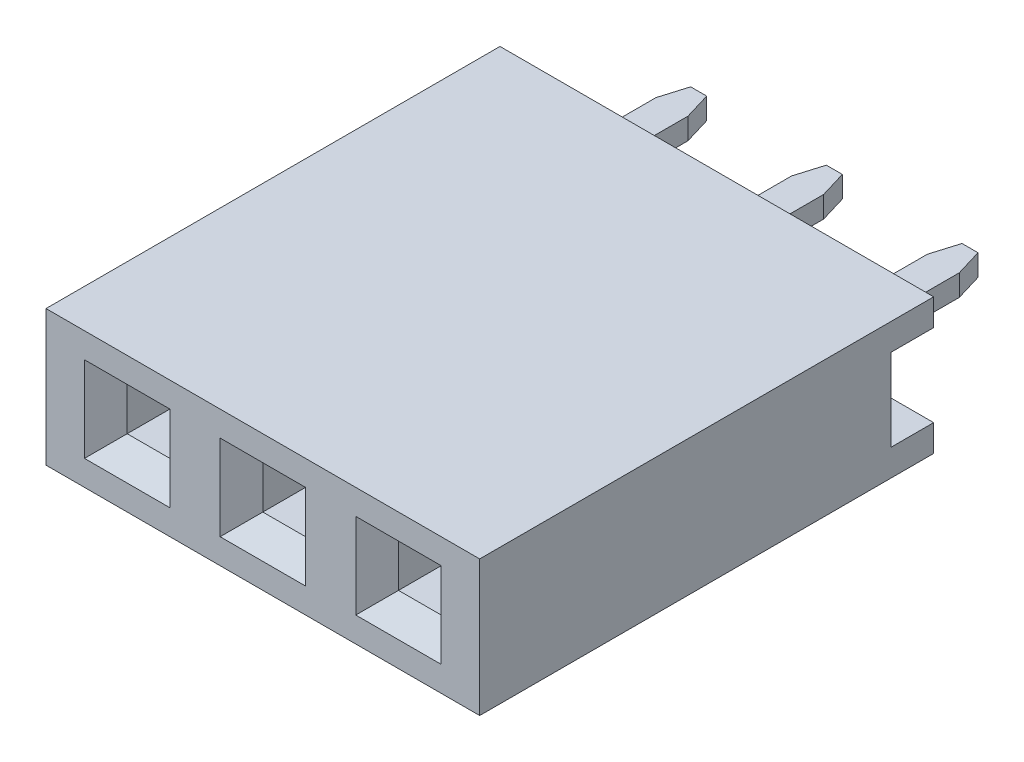
from build123d import *

# Parameters (mm, degrees)
SKETCH1_W           = 2.54
SKETCH1_H           = 8.5
BOSS_EXTRUDE1_DEPTH = 1.52
SKETCH_1_W          = 0.8
SKETCH_1_H          = 1.54
CUT_EXTRUDE_1_DEPTH = 10.116166958
SKETCH2_W           = 0.8
SKETCH2_H           = 0.8
CUT_EXTRUDE1_DEPTH  = 7
CHAMFER_1_SIZE      = 0.4
BOSS_EXTRUDE2_DEPTH = 0.2
LPATTERN1_COUNT     = 3
LPATTERN1_PITCH     = 2.54


with BuildPart() as part:
    # Sketch1 → Boss-Extrude1 (new, symmetric)
    with BuildSketch(Plane(origin=(0, 0, 0), x_dir=(0, -1, 0), z_dir=(1, 0, 0))):
        with Locations((0, -4.25)):
            Rectangle(SKETCH1_W, SKETCH1_H)
    extrude(amount=BOSS_EXTRUDE1_DEPTH, both=True)

    # Эскиз1 → Вырез-Вытянуть1 (cut, through all)
    with BuildSketch(Plane(origin=(1.52, 0, 0), x_dir=(0, 0, -1), z_dir=(1, 0, 0))):
        with Locations((-0.4, 0)):
            Rectangle(SKETCH_1_W, SKETCH_1_H)
    extrude(amount=-CUT_EXTRUDE_1_DEPTH, mode=Mode.SUBTRACT)

    # Sketch2 → Cut-Extrude1 (cut)
    with BuildSketch(Plane(origin=(0, 0, 8.5), x_dir=(-1, 0, 0), z_dir=(0, 0, 1))):
        Rectangle(SKETCH2_W, SKETCH2_H)
    extrude(amount=-CUT_EXTRUDE1_DEPTH, mode=Mode.SUBTRACT)

    # Фаска1
    chamfer_1_edges = [part.edges().sort_by_distance(p)[0] for p in [
        (-0.4, 0, 8.5),
        (0, -0.4, 8.5),
        (0.4, 0, 8.5),
        (0, 0.4, 8.5),
    ]]
    chamfer(chamfer_1_edges, length=CHAMFER_1_SIZE)

    # Sketch3 → Boss-Extrude2 (add, symmetric)
    with BuildSketch(Plane(origin=(0, 0, 0), x_dir=(1, 0, 0), z_dir=(0, 1, 0))):
        Polygon((-0.3, 0), (-0.3, 1.7), (-0.15, 2.2), (0.15, 2.2), (0.3, 1.7), (0.3, 0), (0.3, -0.8), (-0.3, -0.8), align=None)
        Polygon((0.4, -1.5), (-0.4, -1.5), (-0.4, -6.9), (-0.3, -6.9), (-0.3, -1.6), (0.3, -1.6), (0.3, -6.9), (0.4, -6.9), align=None)
    extrude(amount=BOSS_EXTRUDE2_DEPTH, both=True)


with BuildPart() as lpattern1_1:
    # LPattern1: pattern copy
    add(part.part.moved(Location(Vector(1, 0, 0) * (1 * LPATTERN1_PITCH))))


with BuildPart() as lpattern1_2:
    # LPattern1: pattern copy
    add(part.part.moved(Location(Vector(1, 0, 0) * (2 * LPATTERN1_PITCH))))

    # Combine 1: union LPattern1_1, part
    add(lpattern1_1.part)
    add(part.part)


solid = lpattern1_2.part
